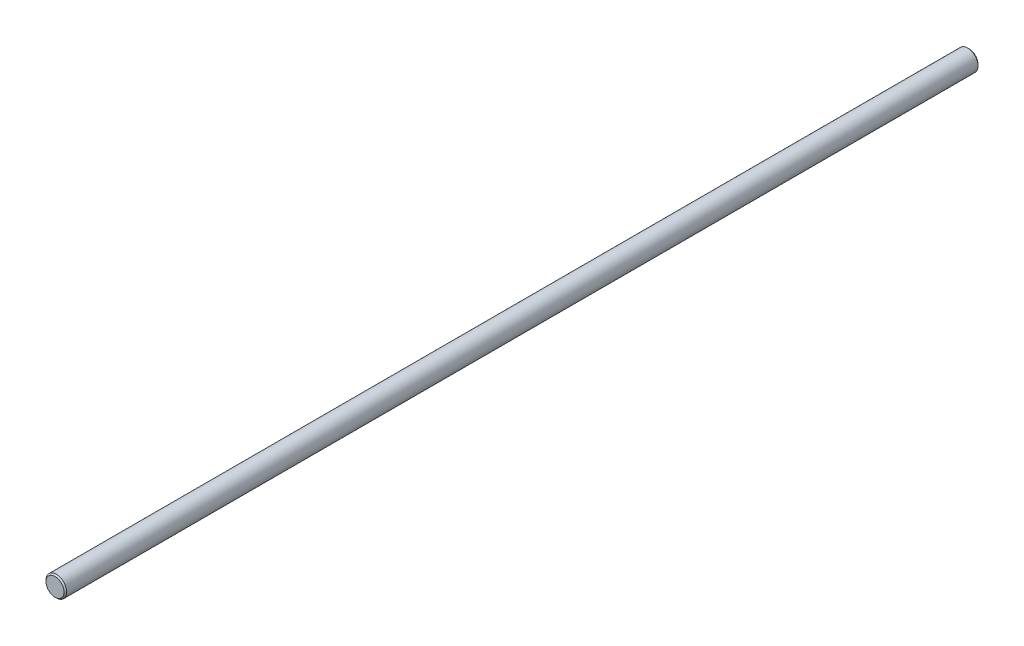
from build123d import *


with BuildPart() as part:
    # Sketch1 → Revolve1 (revolve)
    with BuildSketch(Plane.XZ, mode=Mode.PRIVATE) as revolve1_sk:
        Polygon((3.5, 355), (0, 355), (0, 0), (3.5, 0), (4, 0.5), (4, 354.5), align=None)
    revolve(revolve1_sk.sketch.rotate(Axis((0, 0, 355), (0, 0, -1)), 180), axis=Axis((0, 0, 355), (0, 0, -1)))


solid = part.part
